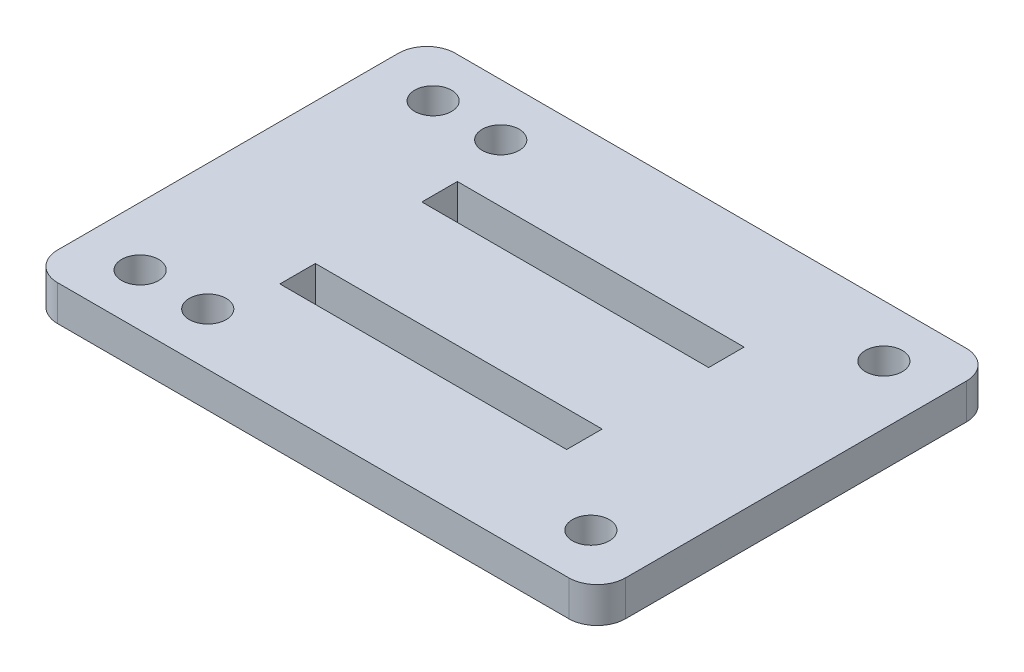
from build123d import *

# Parameters (mm, degrees)
SKETCH_3_W          = 80
SKETCH_3_H          = 56
EXTRUDE_1_DEPTH     = 5
SKETCH_1_R          = 2.6
SKETCH_1_W          = 40.4
SKETCH_1_H          = 5
CUT_EXTRUDE_1_DEPTH = 5
FILLET_2_R          = 4


with BuildPart() as part:
    # 草图3 → 凸台-拉伸1 (new body)
    with BuildSketch(Plane(origin=(0, 0, 0), x_dir=(1, 0, 0), z_dir=(0, 1, 0))):
        Rectangle(SKETCH_3_W, SKETCH_3_H)
    extrude(amount=EXTRUDE_1_DEPTH)

    # 草图1 → 切除-拉伸1 (cut)
    with BuildSketch(Plane(origin=(0, 0, 0), x_dir=(1, 0, 0), z_dir=(0, 1, 0))):
        with Locations(Location((-31.75, 20.6375, 0), (0, 0, 90))):
            Circle(SKETCH_1_R)
        with Locations(Location((31.75, 20.6375, 0), (0, 0, 90))):
            Circle(SKETCH_1_R)
        with Locations(Location((31.75, -20.6375, 0), (0, 0, 90))):
            Circle(SKETCH_1_R)
        with Locations(Location((-31.75, -20.6375, 0), (0, 0, 90))):
            Circle(SKETCH_1_R)
        with Locations(Location((-22.225, 20.6375, 0), (0, 0, 90))):
            Circle(SKETCH_1_R)
        with Locations(Location((-22.225, -20.6375, 0), (0, 0, 90))):
            Circle(SKETCH_1_R)
        with Locations((0, -10)):
            Rectangle(SKETCH_1_W, SKETCH_1_H)
        with Locations((0, 10)):
            Rectangle(SKETCH_1_W, SKETCH_1_H)
    extrude(amount=CUT_EXTRUDE_1_DEPTH, mode=Mode.SUBTRACT)

    # 圆角2
    fillet_2_edges = [part.edges().sort_by_distance(p)[0] for p in [
        (40, 2.5, 28),
        (-40, 2.5, 28),
        (-40, 2.5, -28),
        (40, 2.5, -28),
    ]]
    fillet(fillet_2_edges, radius=FILLET_2_R)


solid = part.part
